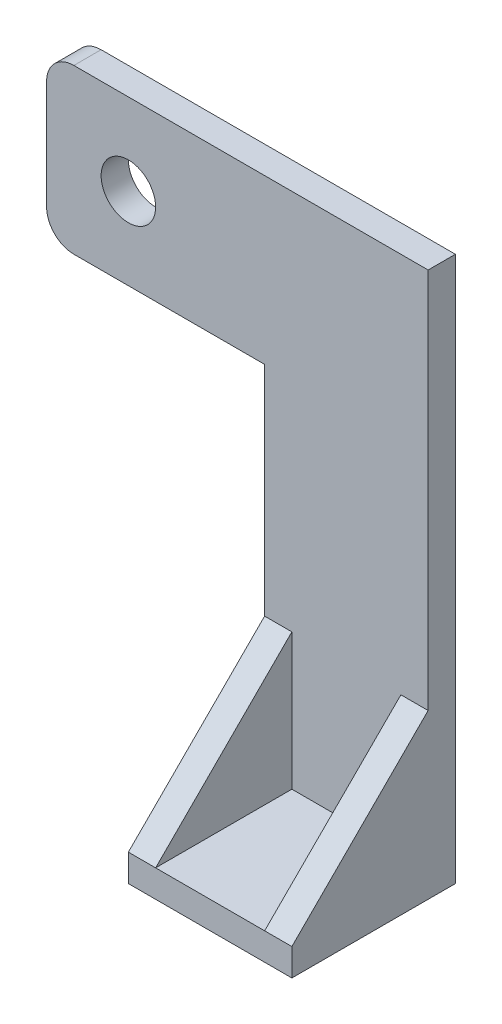
from build123d import *

# Parameters (mm, degrees)
BOSS_EXTRUDE1_DEPTH = 5
SKETCH2_R           = 5
CUT_EXTRUDE1_DEPTH  = 10
SKETCH3_W           = 30
SKETCH3_H           = 30
BOSS_EXTRUDE2_DEPTH = 5
BOSS_EXTRUDE3_DEPTH = 5


with BuildPart() as part:
    # Sketch1 → Boss-Extrude1 (new body)
    with BuildSketch(Plane.XY):
        with BuildLine():
            Line((5, 0), (70, 0))
            Line((70, 0), (70, -30))
            Line((70, -30), (70, -95))
            Line((70, -95), (40, -95))
            Line((40, -95), (40, -30))
            Line((40, -30), (5, -30))
            ThreePointArc((5, -30), (1.464466094, -28.535533906), (0, -25))
            Line((0, -25), (0, -5))
            ThreePointArc((0, -5), (1.464466094, -1.464466094), (5, 0))
        make_face()
    extrude(amount=BOSS_EXTRUDE1_DEPTH)

    # Sketch2 → Cut-Extrude1 (cut)
    with BuildSketch(Plane.XY.offset(5)):
        with Locations((15, -15)):
            Circle(SKETCH2_R)
    extrude(amount=-CUT_EXTRUDE1_DEPTH, mode=Mode.SUBTRACT)

    # Sketch3 → Boss-Extrude2 (add)
    with BuildSketch(Plane.XZ.offset(95)):
        with Locations((55, 15)):
            Rectangle(SKETCH3_W, SKETCH3_H)
    extrude(amount=BOSS_EXTRUDE2_DEPTH)

    # Sketch4 → Boss-Extrude3 (add)
    with BuildSketch(Plane.ZY.offset(-40)):
        Polygon((5, -70), (30, -95), (5, -95), align=None)
    boss_extrude3 = extrude(amount=-BOSS_EXTRUDE3_DEPTH)

    # Mirror1: Boss-Extrude3 across plane
    add(boss_extrude3.mirror(Plane.ZY.offset(-55)))


solid = part.part
